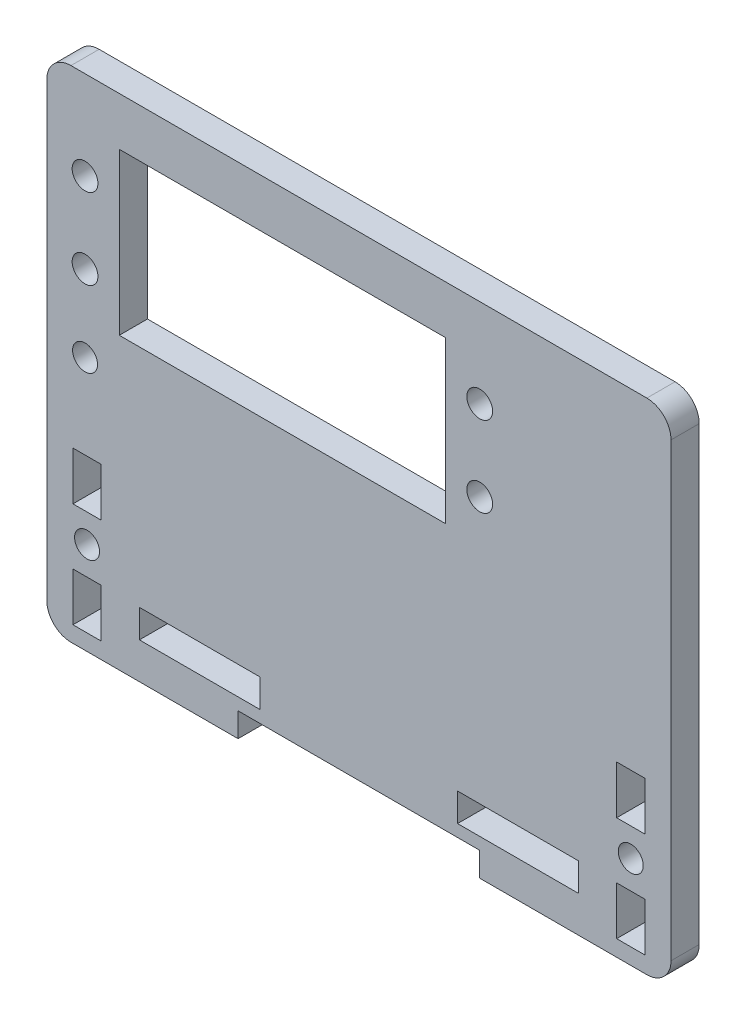
from build123d import *

# Parameters (mm, degrees)
SKETCH1_W               = 40.5
SKETCH1_H               = 20
BOSS_EXTRUDE1_DEPTH     = 3.5
SKETCH2_R               = 1.55
SKETCH2_W               = 3.5
SKETCH2_H               = 6
CUT_EXTRUDE1_DEPTH      = 50.747487374
SKETCH3_W               = 15
SKETCH3_H               = 3.5
CUT_EXTRUDE2_DEPTH      = 50.747487374
CUT_EXTRUDE3_DEPTH      = 50.747487374
CUT_EXTRUDE3_DEPTH_BACK = 50.747487374
SKETCH4_R               = 1.6
CUT_EXTRUDE4_REACH      = 51.747
SKETCH5_R               = 1.55
SKETCH6_W               = 30
SKETCH6_H               = 3
CUT_EXTRUDE5_DEPTH      = 10


with BuildPart() as part:
    # Sketch1 → Boss-Extrude1 (new body)
    with BuildSketch(Plane.XY):
        with BuildLine():
            Line((-35.75, -31), (35.75, -31))
            ThreePointArc((35.75, -31), (37.871320344, -30.121320344), (38.75, -28))
            Line((38.75, -28), (38.75, 28))
            ThreePointArc((38.75, 28), (37.871320344, 30.121320344), (35.75, 31))
            Line((35.75, 31), (-35.75, 31))
            ThreePointArc((-35.75, 31), (-37.871320344, 30.121320344), (-38.75, 28))
            Line((-38.75, 28), (-38.75, -28))
            ThreePointArc((-38.75, -28), (-37.871320344, -30.121320344), (-35.75, -31))
        make_face()
        with Locations((-9.5, 15)):
            Rectangle(SKETCH1_W, SKETCH1_H, mode=Mode.SUBTRACT)
    extrude(amount=BOSS_EXTRUDE1_DEPTH)

    # Sketch2 → Cut-Extrude1 (cut, through all)
    with BuildSketch(Plane.XY.offset(3.5)):
        with Locations((33.75, -19.5)):
            Circle(SKETCH2_R)
        with Locations(Location((-33.75, -19.5, 0), (0, 0, 180))):
            Circle(SKETCH2_R)
        with Locations((33.75, -13)):
            Rectangle(SKETCH2_W, SKETCH2_H)
        with Locations((33.75, -26)):
            Rectangle(SKETCH2_W, SKETCH2_H)
        with Locations((-33.75, -26)):
            Rectangle(SKETCH2_W, SKETCH2_H)
        with Locations((-33.75, -13)):
            Rectangle(SKETCH2_W, SKETCH2_H)
    extrude(amount=-CUT_EXTRUDE1_DEPTH, mode=Mode.SUBTRACT)

    # Sketch3 → Cut-Extrude2 (cut, through all)
    with BuildSketch(Plane.XY.offset(3.5)):
        with Locations((-19.75, -24.75)):
            Rectangle(SKETCH3_W, SKETCH3_H)
        with Locations((19.75, -24.75)):
            Rectangle(SKETCH3_W, SKETCH3_H)
    extrude(amount=-CUT_EXTRUDE2_DEPTH, mode=Mode.SUBTRACT)

    # Sketch4 → Cut-Extrude3 (cut, two sides: drawn at the far end of the back side and taken through both)
    with BuildSketch(Plane.XY.offset(3.5).offset(-CUT_EXTRUDE3_DEPTH_BACK)):
        with Locations((15, 20)):
            Circle(SKETCH4_R)
        with Locations((15, 10)):
            Circle(SKETCH4_R)
        with Locations((-34, 10)):
            Circle(SKETCH4_R)
        with Locations((-34, 20)):
            Circle(SKETCH4_R)
    extrude(amount=CUT_EXTRUDE3_DEPTH + CUT_EXTRUDE3_DEPTH_BACK, mode=Mode.SUBTRACT)

    # Sketch5 → Cut-Extrude4 (cut, up to next)
    with BuildSketch(Plane.XY.offset(3.5), mode=Mode.PRIVATE) as cut_extrude4_sk1:
        with Locations((-34, 0.5)):
            Circle(SKETCH5_R)
    cut_extrude4_tool1 = extrude(cut_extrude4_sk1.sketch, amount=-CUT_EXTRUDE4_REACH, mode=Mode.PRIVATE) & part.part
    add(cut_extrude4_tool1.solids().sort_by_distance((-34, 0.5, 3.5))[0], mode=Mode.SUBTRACT)

    # Sketch6 → Cut-Extrude5 (cut)
    with BuildSketch(Plane.XY.offset(3.5)):
        with Locations((0, -29.5)):
            Rectangle(SKETCH6_W, SKETCH6_H)
    extrude(amount=-CUT_EXTRUDE5_DEPTH, mode=Mode.SUBTRACT)


solid = part.part
